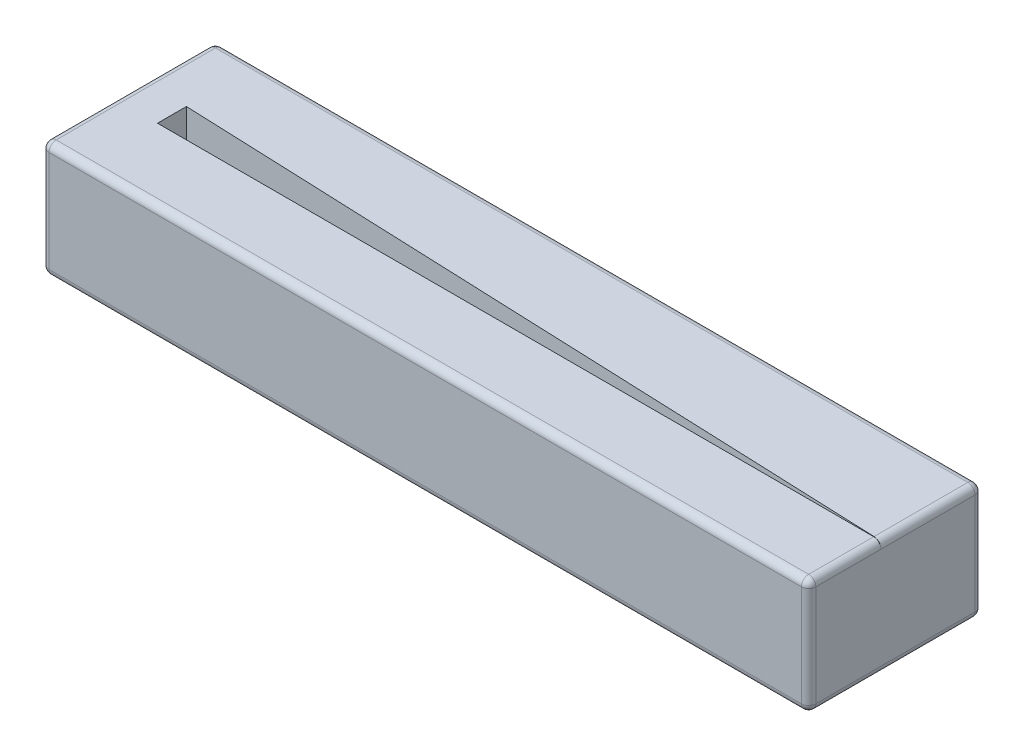
from build123d import *

# Parameters (mm, degrees)
SKETCH1_W             = 50
SKETCH1_H             = 5
BOSS_EXTRUDE1_DEPTH   = 5
BOSS_EXTRUDE1_2_DEPTH = 5
SKETCH2_W             = 50
SKETCH2_H             = 12
BOSS_EXTRUDE2_DEPTH   = 3
SKETCH3_W             = 3
SKETCH3_H             = 12
BOSS_EXTRUDE3_DEPTH   = 8
FILLET1_R             = 0.5


with BuildPart() as part:
    # Sketch1 → Boss-Extrude1 (new body)
    with BuildSketch(Plane(origin=(0, 0, 0), x_dir=(1, 0, 0), z_dir=(0, 1, 0))):
        with Locations((25, -3.5)):
            Rectangle(SKETCH1_W, SKETCH1_H)
    extrude(amount=BOSS_EXTRUDE1_DEPTH)



with BuildPart() as body_2:
    # Sketch1 → Boss-Extrude1 2 (new body)
    with BuildSketch(Plane(origin=(0, 0, 0), x_dir=(1, 0, 0), z_dir=(0, 1, 0))):
        Polygon((0, 6), (0, 1), (50, -0.998001998), (50, 6), align=None)
    extrude(amount=BOSS_EXTRUDE1_2_DEPTH)


with BuildPart() as body_3:
    # Sketch2 → Boss-Extrude2 (new body)
    with BuildSketch(Plane.XZ):
        with Locations((25, 0)):
            Rectangle(SKETCH2_W, SKETCH2_H)
    extrude(amount=BOSS_EXTRUDE2_DEPTH)


with BuildPart() as part_1:
    add(part.part)

    add(body_2.part)  # Boss-Extrude3 merges body 2

    add(body_3.part)  # Boss-Extrude3 merges body 3
    # Sketch3 → Boss-Extrude3 (add)
    with BuildSketch(Plane.XZ.offset(3)):
        with Locations((-1.5, 0)):
            Rectangle(SKETCH3_W, SKETCH3_H)
    extrude(amount=-BOSS_EXTRUDE3_DEPTH)

    # Fillet1
    fillet1_edges = [part_1.edges().sort_by_distance(p)[0] for p in [
        (23.5, 5, -6),
        (-3, 5, 0),
        (-3, 1, -6),
        (-3, 1, 6),
        (23.5, -3, 6),
        (-3, -3, 0),
        (23.5, -3, -6),
        (23.5, 5, 6),
        (50, 5, -2.500999001),
        (50, 1, -6),
        (50, -3, 0),
        (50, 5, 3.5),
        (50, 1, 6),
    ]]
    fillet(fillet1_edges, radius=FILLET1_R)


solid = part_1.part
